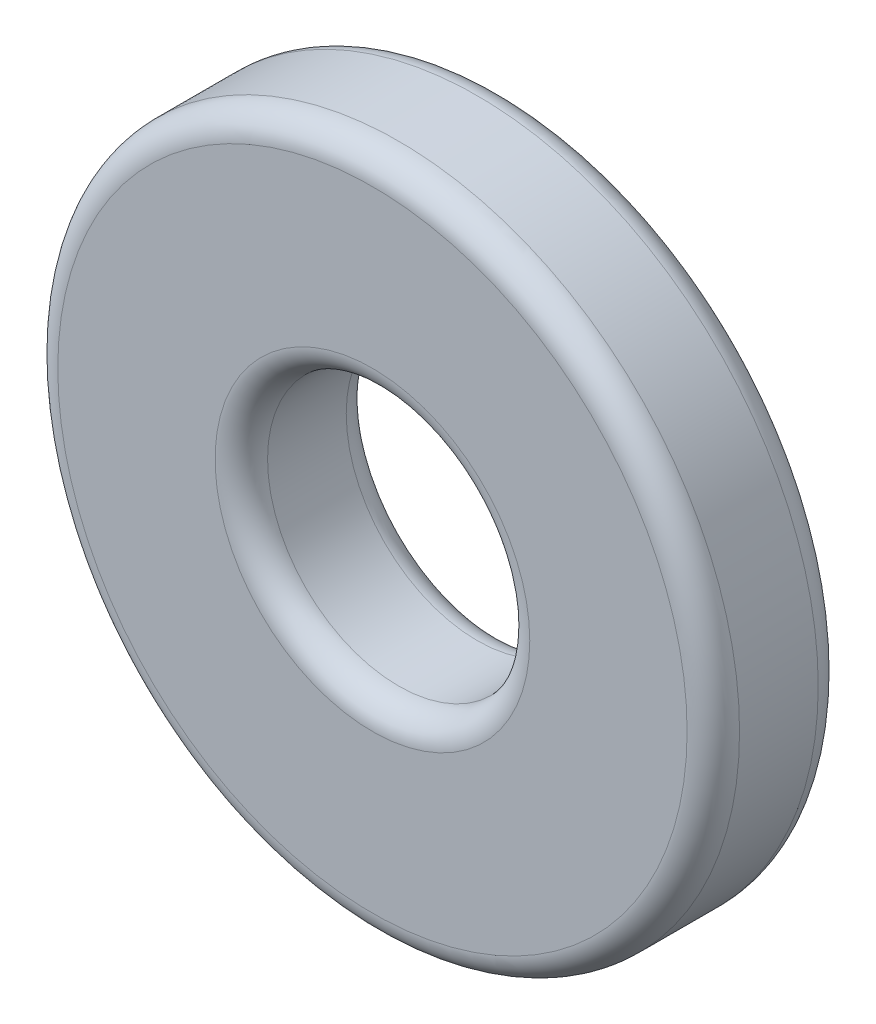
from build123d import *

# Parameters (mm, degrees)
SKETCH_1_R      = 13
SLEEVE_DEPTH    = 5
SKETCH_2_R      = 5
BORE_DEPTH      = 20.052558883
ROUNDED_EDGES_R = 1


with BuildPart() as part:
    # 草图1 → Sleeve (new body)
    with BuildSketch(Plane.XY):
        Circle(SKETCH_1_R)
    extrude(amount=SLEEVE_DEPTH)

    # 草图2 → Bore (cut, through all)
    with BuildSketch(Plane.XY.offset(5)):
        Circle(SKETCH_2_R)
    extrude(amount=-BORE_DEPTH, mode=Mode.SUBTRACT)

    # Rounded_edges
    rounded_edges_edges = [part.edges().sort_by_distance(p)[0] for p in [
        (-13, 0, 0),
        (-13, 0, 5),
        (-5, 0, 0),
        (-5, 0, 5),
    ]]
    fillet(rounded_edges_edges, radius=ROUNDED_EDGES_R)


solid = part.part
